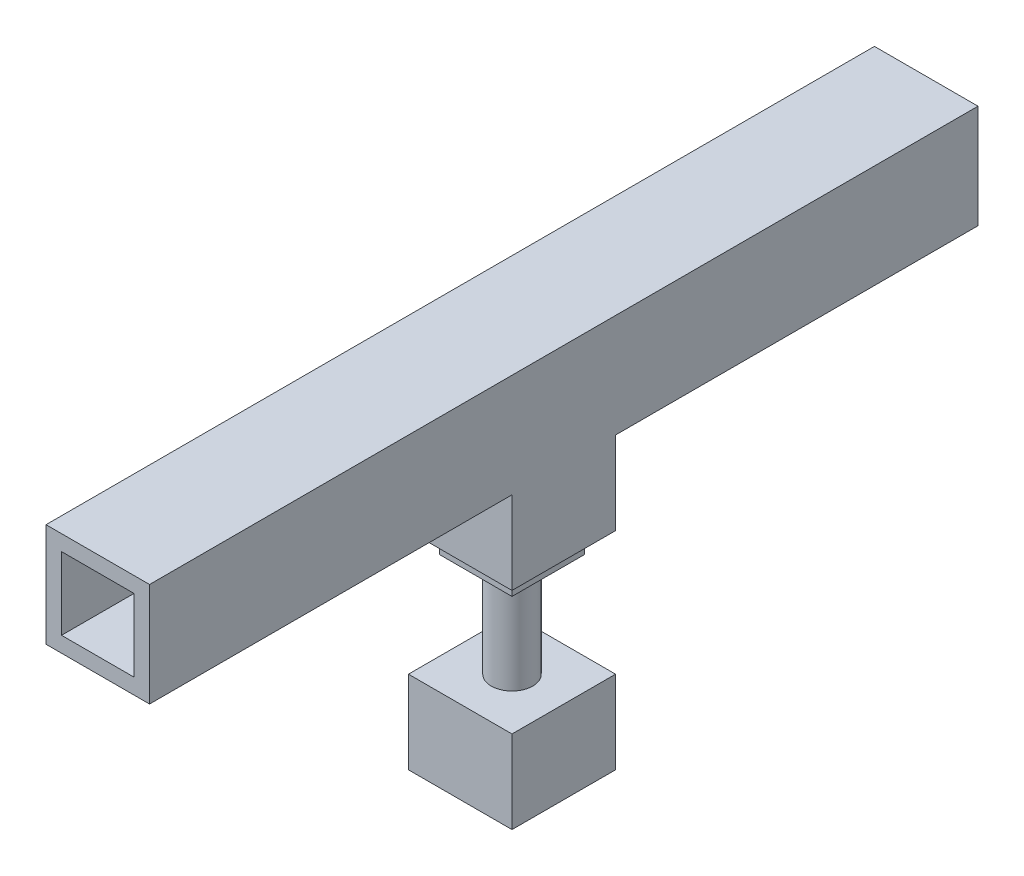
from build123d import *

# Parameters (mm, degrees)
SKETCH_1_W          = 50
SKETCH_1_H          = 50
SKETCH_1_W_2        = 35
SKETCH_1_H_2        = 35
EXTRUDE_1_DEPTH     = 200
SKETCH_2_W          = 50
SKETCH_2_H          = 50
SKETCH_2_W_2        = 35
SKETCH_2_H_2        = 35
EXTRUDE_2_DEPTH     = 40
SKETCH_3_W          = 35
SKETCH_3_H          = 35
CUT_EXTRUDE_1_DEPTH = 60
SKETCH_4_W          = 35
SKETCH_4_H          = 35
SKETCH_4_R          = 10
EXTRUDE_3_DEPTH     = 10
SKETCH_5_R          = 10
SKETCH_5_R_2        = 5
EXTRUDE_4_DEPTH     = 50
SKETCH_6_W          = 50
SKETCH_6_H          = 50
SKETCH_6_R          = 5
EXTRUDE_5_DEPTH     = 40


with BuildPart() as part:
    # Эскиз1 → Бобышка-Вытянуть1 (new, symmetric)
    with BuildSketch(Plane.XY):
        Rectangle(SKETCH_1_W, SKETCH_1_H)
        Rectangle(SKETCH_1_W_2, SKETCH_1_H_2, mode=Mode.SUBTRACT)
    extrude(amount=EXTRUDE_1_DEPTH, both=True)

    # Эскиз2 → Бобышка-Вытянуть2 (add)
    with BuildSketch(Plane.XZ.offset(25)):
        Rectangle(SKETCH_2_W, SKETCH_2_H)
        Rectangle(SKETCH_2_W_2, SKETCH_2_H_2, mode=Mode.SUBTRACT)
    extrude(amount=EXTRUDE_2_DEPTH)

    # Эскиз3 → Вырез-Вытянуть1 (cut)
    with BuildSketch(Plane.XZ.offset(65)):
        Rectangle(SKETCH_3_W, SKETCH_3_H)
    extrude(amount=-CUT_EXTRUDE_1_DEPTH, mode=Mode.SUBTRACT)


with BuildPart() as body_2:
    # Эскиз4 → Бобышка-Вытянуть3 (new body)
    with BuildSketch(Plane.XZ.offset(65)):
        Rectangle(SKETCH_4_W, SKETCH_4_H)
        with Locations(Location((0, 0, 0), (0, 0, 270))):
            Circle(SKETCH_4_R, mode=Mode.SUBTRACT)
    extrude(amount=EXTRUDE_3_DEPTH)


with BuildPart() as body_3:
    # Эскиз5 → Бобышка-Вытянуть4 (new body)
    with BuildSketch(Plane.XZ.offset(75)):
        with Locations(Location((0, 0, 0), (0, 0, 270))):
            Circle(SKETCH_5_R)
        with Locations(Location((0, 0, 0), (0, 0, 270))):
            Circle(SKETCH_5_R_2, mode=Mode.SUBTRACT)
    extrude(amount=EXTRUDE_4_DEPTH)

    # Эскиз6 → Бобышка-Вытянуть5 (add)
    with BuildSketch(Plane.XZ.offset(125)):
        Rectangle(SKETCH_6_W, SKETCH_6_H)
        with Locations(Location((0, 0, 0), (0, 0, 270))):
            Circle(SKETCH_6_R, mode=Mode.SUBTRACT)
    extrude(amount=EXTRUDE_5_DEPTH)


solid = Compound([part.part, body_2.part, body_3.part])
